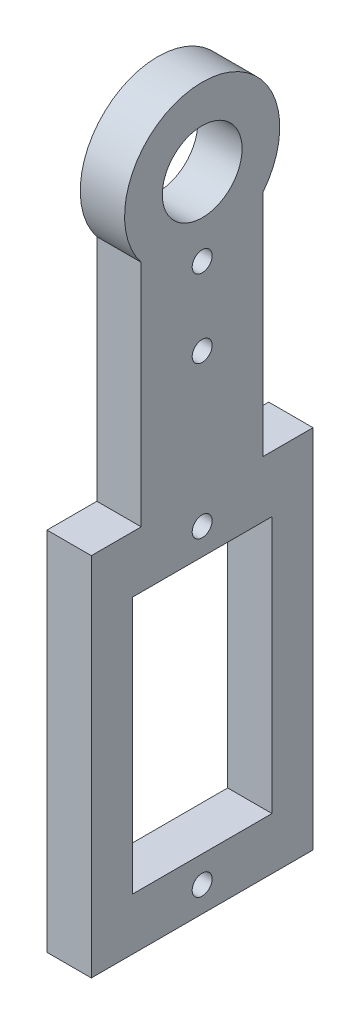
from build123d import *

# Parameters (mm, degrees)
SKETCH1_R           = 7
BOSS_EXTRUDE1_DEPTH = 4
BOSS_EXTRUDE2_START = -5.5
SKETCH2_W           = 4
SKETCH2_H           = 36
BOSS_EXTRUDE2_DEPTH = 11
BOSS_EXTRUDE3_START = -10
SKETCH3_W           = 4
SKETCH3_H           = 33
BOSS_EXTRUDE3_DEPTH = 20
BOSS_EXTRUDE4_START = -1
SKETCH4_R           = 3.6
BOSS_EXTRUDE4_DEPTH = 6
BOSS_EXTRUDE5_START = -1
SKETCH5_R           = 0.9
BOSS_EXTRUDE5_DEPTH = 6
BOSS_EXTRUDE6_START = -1
SKETCH6_R           = 0.9
BOSS_EXTRUDE6_DEPTH = 6
BOSS_EXTRUDE7_START = -6.3
SKETCH7_W           = 6
SKETCH7_H           = 23.2
BOSS_EXTRUDE7_DEPTH = 12.6
BOSS_EXTRUDE8_START = -1
SKETCH8_R           = 0.9
BOSS_EXTRUDE8_DEPTH = 6
BOSS_EXTRUDE9_START = -1
SKETCH9_R           = 0.9
BOSS_EXTRUDE9_DEPTH = 6


with BuildPart() as part:
    # Sketch1 → Boss-Extrude1 (new body)
    with BuildSketch(Plane(origin=(0, 0, 0), x_dir=(0, 0, -1), z_dir=(1, 0, 0))):
        Circle(SKETCH1_R)
    extrude(amount=BOSS_EXTRUDE1_DEPTH)

    # Sketch2 → Boss-Extrude2 (add)
    with BuildSketch(Plane.XY.offset(BOSS_EXTRUDE2_START)):
        with Locations((2, -18)):
            Rectangle(SKETCH2_W, SKETCH2_H)
    extrude(amount=BOSS_EXTRUDE2_DEPTH)

    # Sketch3 → Boss-Extrude3 (add)
    with BuildSketch(Plane.XY.offset(BOSS_EXTRUDE3_START)):
        with Locations((2, -41.5)):
            Rectangle(SKETCH3_W, SKETCH3_H)
    extrude(amount=BOSS_EXTRUDE3_DEPTH)


with BuildPart() as body_2:
    # Sketch4 → Boss-Extrude4 (new body)
    with BuildSketch(Plane(origin=(0, 0, 0), x_dir=(0, 0, -1), z_dir=(1, 0, 0)).offset(BOSS_EXTRUDE4_START)):
        Circle(SKETCH4_R)
    extrude(amount=BOSS_EXTRUDE4_DEPTH)


with BuildPart() as part_1:
    add(part.part)

    # Combine1: cut body 2
    add(body_2.part, mode=Mode.SUBTRACT)


with BuildPart() as body_2_2:
    # Sketch5 → Boss-Extrude5 (new body)
    with BuildSketch(Plane(origin=(0, 0, 0), x_dir=(0, 0, -1), z_dir=(1, 0, 0)).offset(BOSS_EXTRUDE5_START)):
        with Locations((0, -7)):
            Circle(SKETCH5_R)
    extrude(amount=BOSS_EXTRUDE5_DEPTH)


with BuildPart() as part_2:
    add(part_1.part)

    # Combine2: cut body 2 2
    add(body_2_2.part, mode=Mode.SUBTRACT)


with BuildPart() as body_2_3:
    # Sketch6 → Boss-Extrude6 (new body)
    with BuildSketch(Plane(origin=(0, 0, 0), x_dir=(0, 0, -1), z_dir=(1, 0, 0)).offset(BOSS_EXTRUDE6_START)):
        with Locations((0, -14)):
            Circle(SKETCH6_R)
    extrude(amount=BOSS_EXTRUDE6_DEPTH)


with BuildPart() as part_3:
    add(part_2.part)

    # Combine3: cut body 2 3
    add(body_2_3.part, mode=Mode.SUBTRACT)


with BuildPart() as body_2_4:
    # Sketch7 → Boss-Extrude7 (new body)
    with BuildSketch(Plane.XY.offset(BOSS_EXTRUDE7_START)):
        with Locations((2, -41.7)):
            Rectangle(SKETCH7_W, SKETCH7_H)
    extrude(amount=BOSS_EXTRUDE7_DEPTH)


with BuildPart() as part_4:
    add(part_3.part)

    # Combine4: cut body 2 4
    add(body_2_4.part, mode=Mode.SUBTRACT)


with BuildPart() as body_2_5:
    # Sketch8 → Boss-Extrude8 (new body)
    with BuildSketch(Plane(origin=(0, 0, 0), x_dir=(0, 0, -1), z_dir=(1, 0, 0)).offset(BOSS_EXTRUDE8_START)):
        with Locations((0, -27.7)):
            Circle(SKETCH8_R)
    extrude(amount=BOSS_EXTRUDE8_DEPTH)


with BuildPart() as part_5:
    add(part_4.part)

    # Combine5: cut body 2 5
    add(body_2_5.part, mode=Mode.SUBTRACT)


with BuildPart() as body_2_6:
    # Sketch9 → Boss-Extrude9 (new body)
    with BuildSketch(Plane(origin=(0, 0, 0), x_dir=(0, 0, -1), z_dir=(1, 0, 0)).offset(BOSS_EXTRUDE9_START)):
        with Locations((0, -55.7)):
            Circle(SKETCH9_R)
    extrude(amount=BOSS_EXTRUDE9_DEPTH)


with BuildPart() as part_6:
    add(part_5.part)

    # Combine6: cut body 2 6
    add(body_2_6.part, mode=Mode.SUBTRACT)


solid = part_6.part
